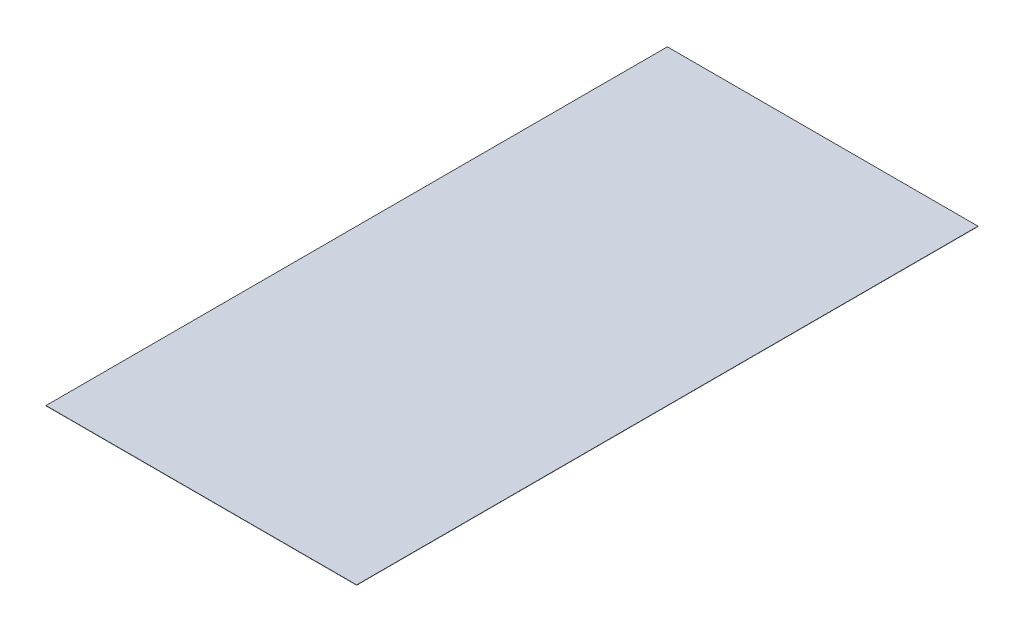
from build123d import *

# Parameters (mm, degrees)
ESQUISSE1_W        = 1250
ESQUISSE1_H        = 2500
BOSS_EXTRU_1_DEPTH = 1


with BuildPart() as part:
    # Esquisse1 → Boss.-Extru.1 (new body)
    with BuildSketch(Plane(origin=(0, 0, 0), x_dir=(1, 0, 0), z_dir=(0, 1, 0))):
        Rectangle(ESQUISSE1_W, ESQUISSE1_H)
    extrude(amount=BOSS_EXTRU_1_DEPTH)


solid = part.part
